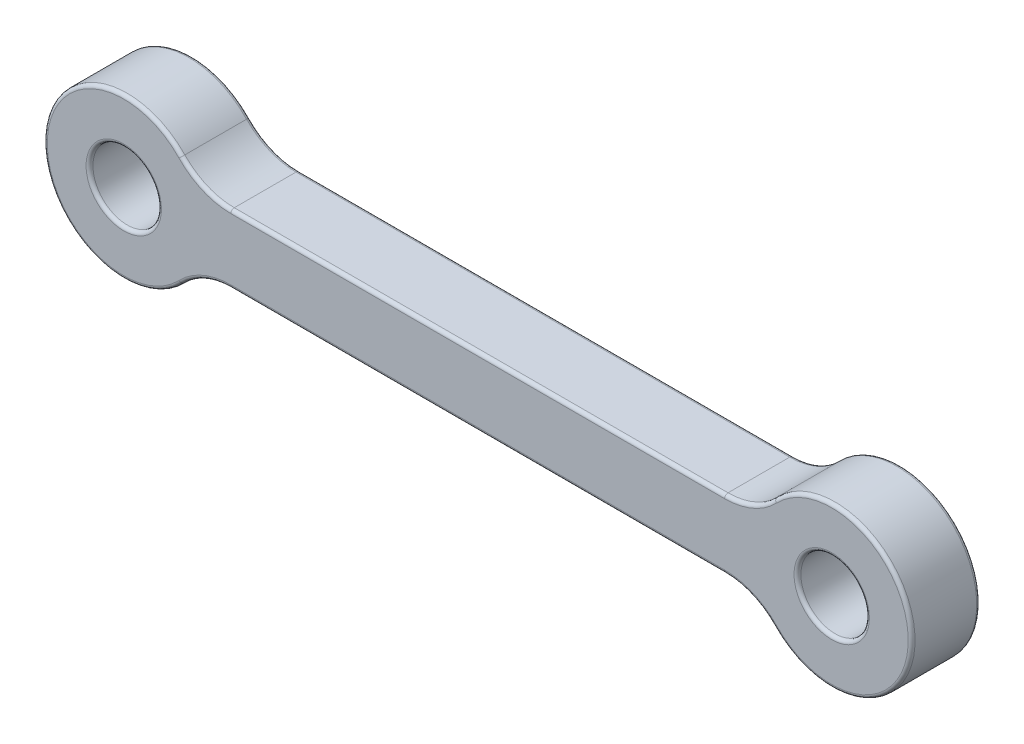
from build123d import *

# Parameters (mm, degrees)
SKETCH1_R           = 3.5
SKETCH1_R_2         = 1.5
BOSS_EXTRUDE1_DEPTH = 1.5
FILLET1_R           = 3
FILLET3_R           = 0.15


with BuildPart() as part:
    # Sketch1 → Boss-Extrude1 (new, symmetric)
    # profile 1 of 3: a face of its own
    with BuildSketch(Plane.XY):
        Circle(SKETCH1_R)
        Circle(SKETCH1_R_2, mode=Mode.SUBTRACT)
    # profile 2 of 3: a face of its own
    with BuildSketch(Plane.XY):
        with BuildLine():
            Line((3.16227766, -1.5), (27.83772234, -1.5))
            ThreePointArc((27.83772234, -1.5), (27.5, 0), (27.83772234, 1.5))
            Line((27.83772234, 1.5), (3.16227766, 1.5))
            ThreePointArc((3.16227766, 1.5), (3.414525722, 0.768774411), (3.5, 0))
            ThreePointArc((3.5, 0), (3.414525722, -0.768774411), (3.16227766, -1.5))
        make_face()
    # profile 3 of 3: a face of its own
    with BuildSketch(Plane.XY):
        with Locations((31, 0)):
            Circle(SKETCH1_R)
        with Locations((31, 0)):
            Circle(SKETCH1_R_2, mode=Mode.SUBTRACT)
    extrude(amount=BOSS_EXTRUDE1_DEPTH, both=True)

    # Fillet1
    fillet1_edges = [part.edges().sort_by_distance(p)[0] for p in [
        (27.83772234, 1.5, 0),
        (27.83772234, -1.5, 0),
        (3.16227766, -1.5, 0),
        (3.16227766, 1.5, 0),
    ]]
    fillet(fillet1_edges, radius=FILLET1_R)

    # Fillet3
    fillet3_edges = [part.edges().sort_by_distance(p)[0] for p in [
        (34.5, 0, -1.5),
        (34.5, 0, 1.5),
        (-1.5, 0, 1.5),
        (15.5, -1.5, -1.5),
        (15.5, -1.5, 1.5),
        (-3.5, 0, -1.5),
        (-3.5, 0, 1.5),
        (29.5, 0, 1.5),
        (15.5, 1.5, -1.5),
        (15.5, 1.5, 1.5),
        (27.486281051, -1.740401367, -1.5),
        (27.486281051, -1.740401367, 1.5),
        (3.513718949, -1.740401367, -1.5),
        (3.513718949, -1.740401367, 1.5),
        (27.486281051, 1.740401367, -1.5),
        (27.486281051, 1.740401367, 1.5),
        (3.513718949, 1.740401367, -1.5),
        (3.513718949, 1.740401367, 1.5),
        (29.5, 0, -1.5),
        (-1.5, 0, -1.5),
    ]]
    fillet(fillet3_edges, radius=FILLET3_R)


solid = part.part
